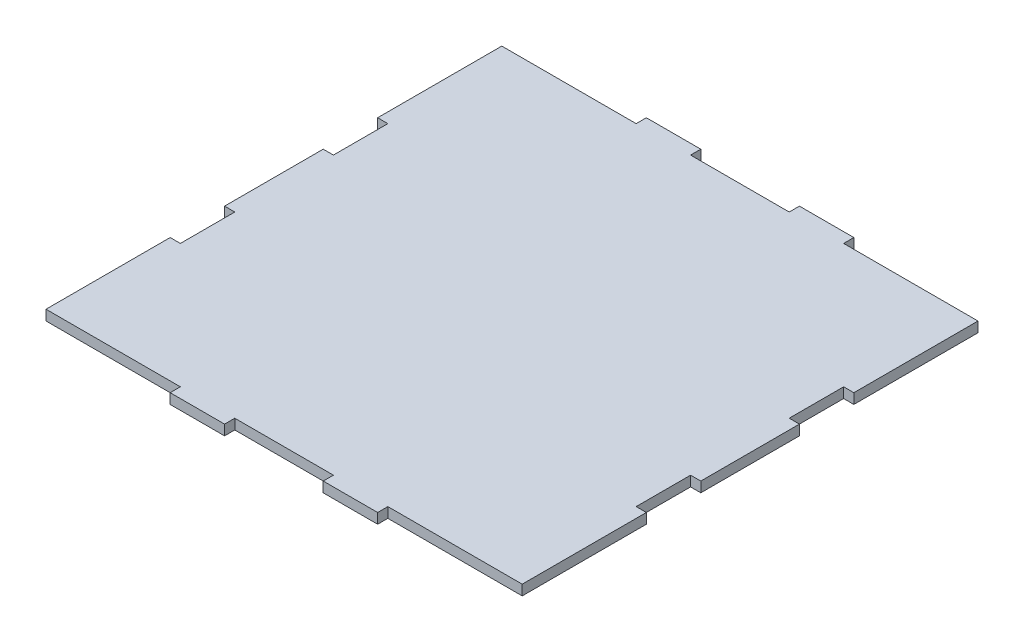
from build123d import *

# Parameters (mm, degrees)
SKETCH1_W           = 140
SKETCH1_H           = 140
BOSS_EXTRUDE1_DEPTH = 3
SKETCH2_W           = 39.5
SKETCH2_H           = 3
SKETCH2_W_2         = 29
CUT_EXTRUDE2_DEPTH  = 3
SKETCH4_W           = 3
SKETCH4_H           = 16
CUT_EXTRUDE3_DEPTH  = 3


with BuildPart() as part:
    # Sketch1 → Boss-Extrude1 (new body)
    with BuildSketch(Plane(origin=(0, 0, 0), x_dir=(1, 0, 0), z_dir=(0, 1, 0))):
        Rectangle(SKETCH1_W, SKETCH1_H)
    extrude(amount=BOSS_EXTRUDE1_DEPTH)

    # Sketch2 → Cut-Extrude2 (cut)
    with BuildSketch(Plane(origin=(0, 3, 0), x_dir=(1, 0, 0), z_dir=(0, 1, 0))):
        with Locations((-50.25, 68.5)):
            Rectangle(SKETCH2_W, SKETCH2_H)
        with Locations((-50.25, -68.5)):
            Rectangle(SKETCH2_W, SKETCH2_H)
        with Locations((50.25, -68.5)):
            Rectangle(SKETCH2_W, SKETCH2_H)
        with Locations((50.25, 68.5)):
            Rectangle(SKETCH2_W, SKETCH2_H)
        with Locations((0, 68.5)):
            Rectangle(SKETCH2_W_2, SKETCH2_H)
        with Locations((0, -68.5)):
            Rectangle(SKETCH2_W_2, SKETCH2_H)
    extrude(amount=-CUT_EXTRUDE2_DEPTH, mode=Mode.SUBTRACT)

    # Sketch4 → Cut-Extrude3 (cut)
    with BuildSketch(Plane(origin=(0, 3, 0), x_dir=(1, 0, 0), z_dir=(0, 1, 0))):
        with Locations((-68.5, 22.5)):
            Rectangle(SKETCH4_W, SKETCH4_H)
        with Locations((-68.5, -22.5)):
            Rectangle(SKETCH4_W, SKETCH4_H)
        with Locations((68.5, 22.5)):
            Rectangle(SKETCH4_W, SKETCH4_H)
        with Locations((68.5, -22.5)):
            Rectangle(SKETCH4_W, SKETCH4_H)
    extrude(amount=-CUT_EXTRUDE3_DEPTH, mode=Mode.SUBTRACT)


solid = part.part
